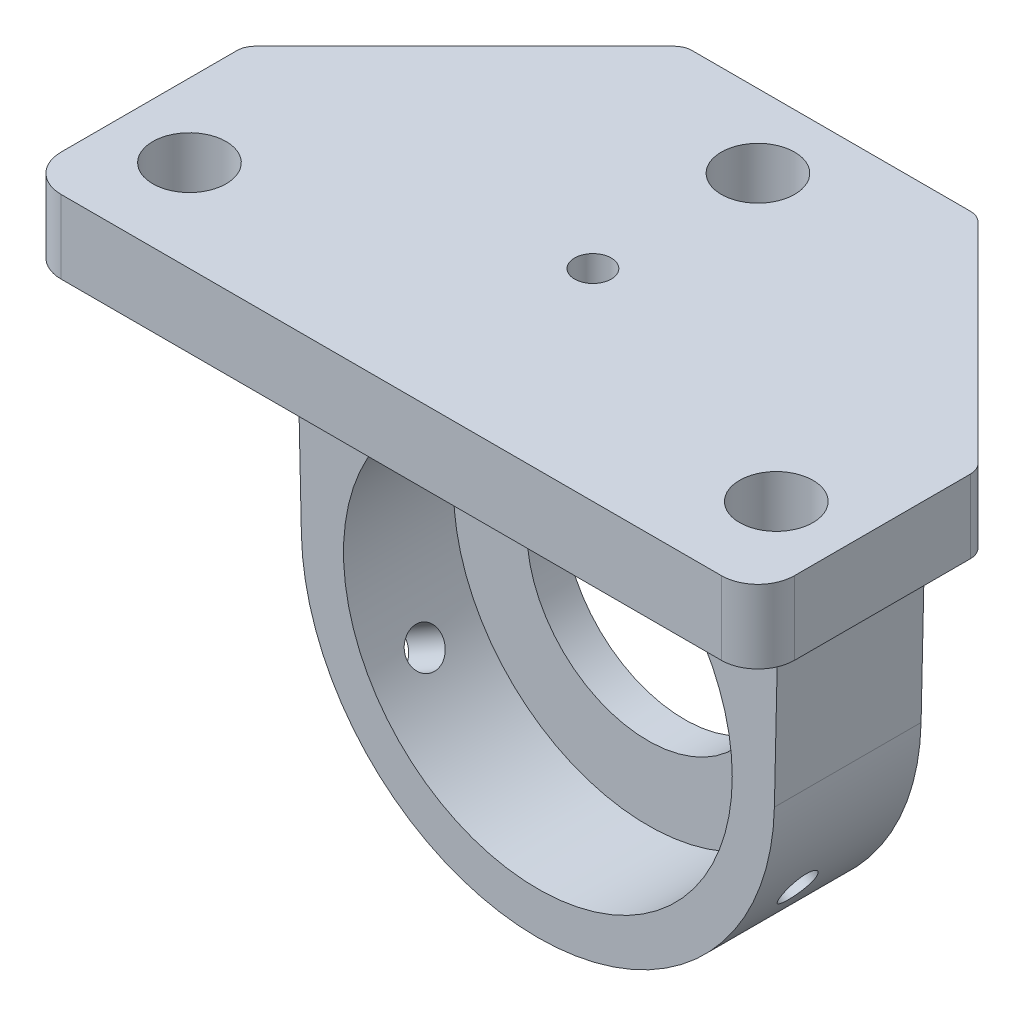
from build123d import *

# Parameters (mm, degrees)
BOSS_EXTRUDE1_DEPTH = 12.7
SKETCH3_R           = 6.35
CUT_EXTRUDE1_DEPTH  = 76.134213245
BOSS_EXTRUDE2_DEPTH = 12.7
SKETCH5_R           = 33.655
CUT_EXTRUDE2_DEPTH  = 126.483214241
BOSS_EXTRUDE3_START = -6.35
SKETCH6_R           = 33.655
SKETCH6_R_2         = 20.955
BOSS_EXTRUDE3_DEPTH = 6.35
CUT_EXTRUDE3_REACH  = 122.901
SKETCH7_R           = 3.175
CIRPATTERN1_COUNT   = 3
CUT_EXTRUDE4_DEPTH  = 112.134524666
FILLET1_R           = 3.175


with BuildPart() as part:
    # Sketch1 → Boss-Extrude1 (new body)
    with BuildSketch(Plane(origin=(0, 0, 0), x_dir=(1, 0, 0), z_dir=(0, 1, 0))):
        with BuildLine():
            Line((-57.15, 38.1), (57.15, 38.1))
            ThreePointArc((57.15, 38.1), (61.640128061, 36.240128061), (63.5, 31.75))
            Line((63.5, 31.75), (63.5, -31.75))
            ThreePointArc((63.5, -31.75), (61.640128061, -36.240128061), (57.15, -38.1))
            Line((57.15, -38.1), (-57.15, -38.1))
            ThreePointArc((-57.15, -38.1), (-61.640128061, -36.240128061), (-63.5, -31.75))
            Line((-63.5, -31.75), (-63.5, 31.75))
            ThreePointArc((-63.5, 31.75), (-61.640128061, 36.240128061), (-57.15, 38.1))
        make_face()
    extrude(amount=-BOSS_EXTRUDE1_DEPTH)

    # Sketch3 → Cut-Extrude1 (cut, through all)
    with BuildSketch(Plane.XZ.offset(12.7)):
        with Locations((-50.8, 22.225)):
            Circle(SKETCH3_R)
        with Locations((50.8, 22.225)):
            Circle(SKETCH3_R)
        with Locations((0, -25.4)):
            Circle(SKETCH3_R)
    extrude(amount=-CUT_EXTRUDE1_DEPTH, mode=Mode.SUBTRACT)

    # Sketch2 → Boss-Extrude2 (add, symmetric)
    with BuildSketch(Plane.XY):
        with BuildLine():
            Line((-41.91, -12.7), (-40.947154642, -55.530506915))
            ThreePointArc((-40.947154642, -55.530506915), (0, -95.5675), (40.947154642, -55.530506915))
            Line((40.947154642, -55.530506915), (41.91, -12.7))
            Line((41.91, -12.7), (-41.91, -12.7))
        make_face()
    extrude(amount=BOSS_EXTRUDE2_DEPTH, both=True)

    # Sketch5 → Cut-Extrude2 (cut, through all)
    with BuildSketch(Plane.XY.offset(12.7)):
        with Locations((0, -54.61)):
            Circle(SKETCH5_R)
    extrude(amount=-CUT_EXTRUDE2_DEPTH, mode=Mode.SUBTRACT)

    # Sketch6 → Boss-Extrude3 (add)
    with BuildSketch(Plane(origin=(0, 0, -12.7), x_dir=(-1, 0, 0), z_dir=(0, 0, -1)).offset(BOSS_EXTRUDE3_START)):
        with Locations((0, -54.61)):
            Circle(SKETCH6_R)
        with Locations((0, -54.61)):
            Circle(SKETCH6_R_2, mode=Mode.SUBTRACT)
    extrude(amount=BOSS_EXTRUDE3_DEPTH)

    # Sketch7 → Cut-Extrude3 (cut, up to next)
    with BuildSketch(Plane(origin=(0, 0, 0), x_dir=(1, 0, 0), z_dir=(0, 1, 0)), mode=Mode.PRIVATE) as cut_extrude3_sk1:
        with Locations((0, -3.175)):
            Circle(SKETCH7_R)
    cut_extrude3_tool1 = extrude(cut_extrude3_sk1.sketch, amount=-CUT_EXTRUDE3_REACH, mode=Mode.PRIVATE) & part.part
    cut_extrude3 = cut_extrude3_tool1.solids().sort_by_distance((0, 0, 3.175))[0]
    add(cut_extrude3, mode=Mode.SUBTRACT)

    # CirPattern1: Cut-Extrude3 ×3 about axis
    cirpattern1_axis = Axis((0, -54.61, 12.7), (0, 0, 1))
    for i in range(1, CIRPATTERN1_COUNT):
        add(cut_extrude3.rotate(cirpattern1_axis, i * 360 / CIRPATTERN1_COUNT), mode=Mode.SUBTRACT)

    # Sketch8 → Cut-Extrude4 (cut, through all)
    with BuildSketch(Plane.XZ.offset(12.7)):
        with BuildLine():
            Line((-63.5, 0), (-25.4, -38.1))
            Line((-25.4, -38.1), (-57.15, -38.1))
            ThreePointArc((-57.15, -38.1), (-61.640128061, -36.240128061), (-63.5, -31.75))
            Line((-63.5, -31.75), (-63.5, 0))
        make_face()
        with BuildLine():
            Line((57.15, -38.1), (25.4, -38.1))
            Line((25.4, -38.1), (63.5, 0))
            Line((63.5, 0), (63.5, -31.75))
            ThreePointArc((63.5, -31.75), (61.640128061, -36.240128061), (57.15, -38.1))
        make_face()
    extrude(amount=-CUT_EXTRUDE4_DEPTH, mode=Mode.SUBTRACT)

    # Fillet1
    fillet1_edges = [part.edges().sort_by_distance(p)[0] for p in [
        (0, -12.7, -12.7),
        (-41.91, -12.7, 0),
        (41.91, -12.7, 0),
        (0, -12.7, 12.7),
        (63.5, -6.35, 0),
        (-63.5, -6.35, 0),
        (25.4, -6.35, -38.1),
        (-25.4, -6.35, -38.1),
    ]]
    fillet(fillet1_edges, radius=FILLET1_R)


solid = part.part
